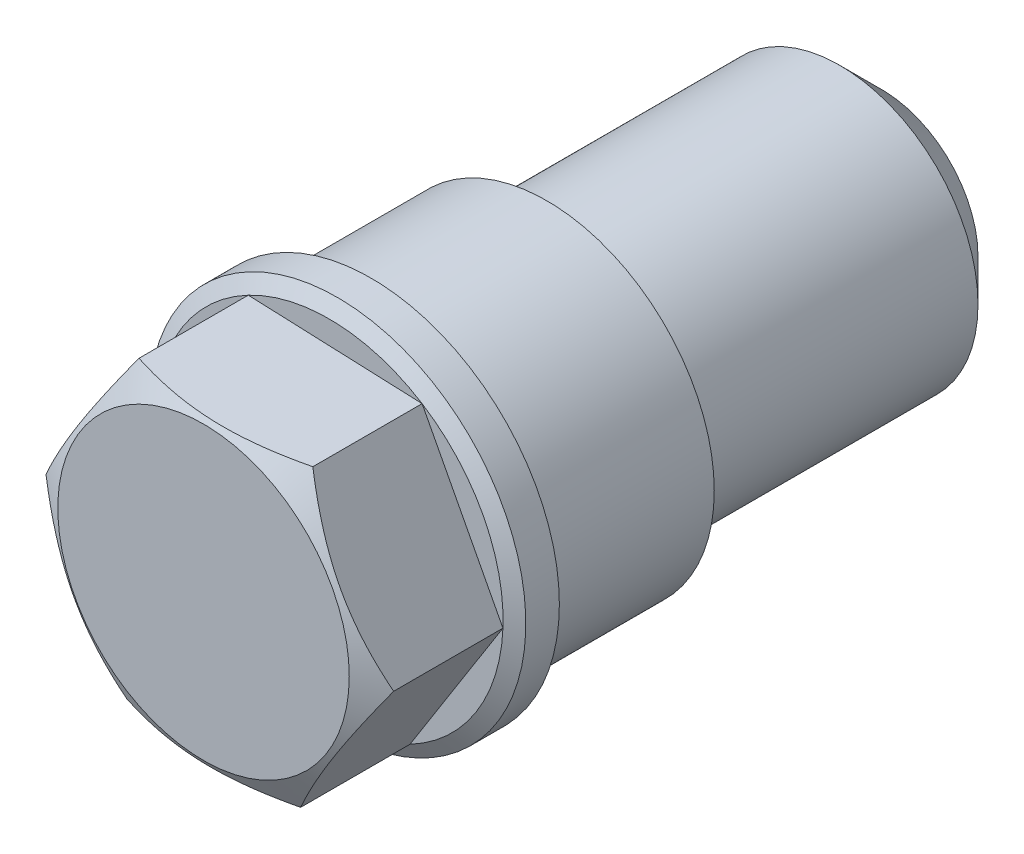
from build123d import *

# Parameters (mm, degrees)
SKETCH_1_R          = 3.3
EXTRUDE_1_DEPTH     = 8
SKETCH_2_R          = 4
EXTRUDE_2_DEPTH     = 4.2
SKETCH_3_R          = 4.5
EXTRUDE_3_DEPTH     = 1
SKETCH_4_OUTSIDE_W  = 18.132
SKETCH_4_OUTSIDE_H  = 18.132
SKETCH_4_OUTSIDE_R  = 4.155576512
CUT_EXTRUDE_1_DEPTH = 1
CUT_EXTRUDE_1_DRAFT = -60
EXTRUDE_4_DEPTH     = 3
SKETCH_6_OUTSIDE_W  = 25.512
SKETCH_6_OUTSIDE_H  = 25.512
SKETCH_6_OUTSIDE_R  = 3.481100129
CUT_EXTRUDE_2_DEPTH = 3
CUT_EXTRUDE_2_DRAFT = -60
CHAMFER_1_SIZE      = 1


with BuildPart() as part:
    # Эскиз1 → Бобышка-Вытянуть1 (new body)
    with BuildSketch(Plane.XY):
        Circle(SKETCH_1_R)
    extrude(amount=EXTRUDE_1_DEPTH)

    # Эскиз2 → Бобышка-Вытянуть2 (add)
    with BuildSketch(Plane.XY.offset(8)):
        Circle(SKETCH_2_R)
    extrude(amount=EXTRUDE_2_DEPTH)

    # Эскиз3 → Бобышка-Вытянуть3 (add)
    with BuildSketch(Plane.XY.offset(12.2)):
        Circle(SKETCH_3_R)
    extrude(amount=EXTRUDE_3_DEPTH)


with BuildPart() as cut_extrude_1_tool:
    # Эскиз4 outside → Вырез-Вытянуть1 (with draft: the straight prism first)
    with BuildSketch(Plane.XY.offset(13.2)):
        Rectangle(SKETCH_4_OUTSIDE_W, SKETCH_4_OUTSIDE_H)
        Circle(SKETCH_4_OUTSIDE_R, mode=Mode.SUBTRACT)
    extrude(amount=-CUT_EXTRUDE_1_DEPTH)
    # Вырез-Вытянуть1: the draft: its side faces are tilted about the plane it starts from
    cut_extrude_1_sides = [cut_extrude_1_tool.faces().sort_by_distance(p)[0] for p in [
        (0, -9.066, 12.7),
        (9.066, 0, 12.7),
        (0, 9.066, 12.7),
        (-9.066, 0, 12.7),
        (-4.155576512, 0, 12.7),
    ]]
    draft(cut_extrude_1_sides, Plane.XY.offset(13.2), CUT_EXTRUDE_1_DRAFT)


with BuildPart() as part_1:
    add(part.part)

    # Вырез-Вытянуть1: cut by cut_extrude_1_tool
    add(cut_extrude_1_tool.part, mode=Mode.SUBTRACT)

    # Эскиз5 → Бобышка-Вытянуть4 (add)
    with BuildSketch(Plane.XY.offset(13.2)):
        Polygon((-4.152198442, 0.167523856), (-2.221179136, -3.512147404), (1.931019306, -3.679671261), (4.152198442, -0.167523856), (2.221179136, 3.512147404), (-1.931019306, 3.679671261), align=None)
    extrude(amount=EXTRUDE_4_DEPTH)


with BuildPart() as cut_extrude_2_tool:
    # Эскиз6 outside → Вырез-Вытянуть2 (with draft: the straight prism first)
    with BuildSketch(Plane.XY.offset(16.2)):
        Rectangle(SKETCH_6_OUTSIDE_W, SKETCH_6_OUTSIDE_H)
        Circle(SKETCH_6_OUTSIDE_R, mode=Mode.SUBTRACT)
    extrude(amount=-CUT_EXTRUDE_2_DEPTH)
    # Вырез-Вытянуть2: the draft: its side faces are tilted about the plane it starts from
    cut_extrude_2_sides = [cut_extrude_2_tool.faces().sort_by_distance(p)[0] for p in [
        (0, -12.756, 14.7),
        (12.756, 0, 14.7),
        (0, 12.756, 14.7),
        (-12.756, 0, 14.7),
        (-3.481100129, 0, 14.7),
    ]]
    draft(cut_extrude_2_sides, Plane.XY.offset(16.2), CUT_EXTRUDE_2_DRAFT)


with BuildPart() as part_2:
    add(part_1.part)

    # Вырез-Вытянуть2: cut by cut_extrude_2_tool
    add(cut_extrude_2_tool.part, mode=Mode.SUBTRACT)

    # Фаска1
    chamfer_1_edges = [part_2.edges().sort_by_distance(p)[0] for p in [
        (-3.3, 0, 0),
    ]]
    chamfer(chamfer_1_edges, length=CHAMFER_1_SIZE)


solid = part_2.part
